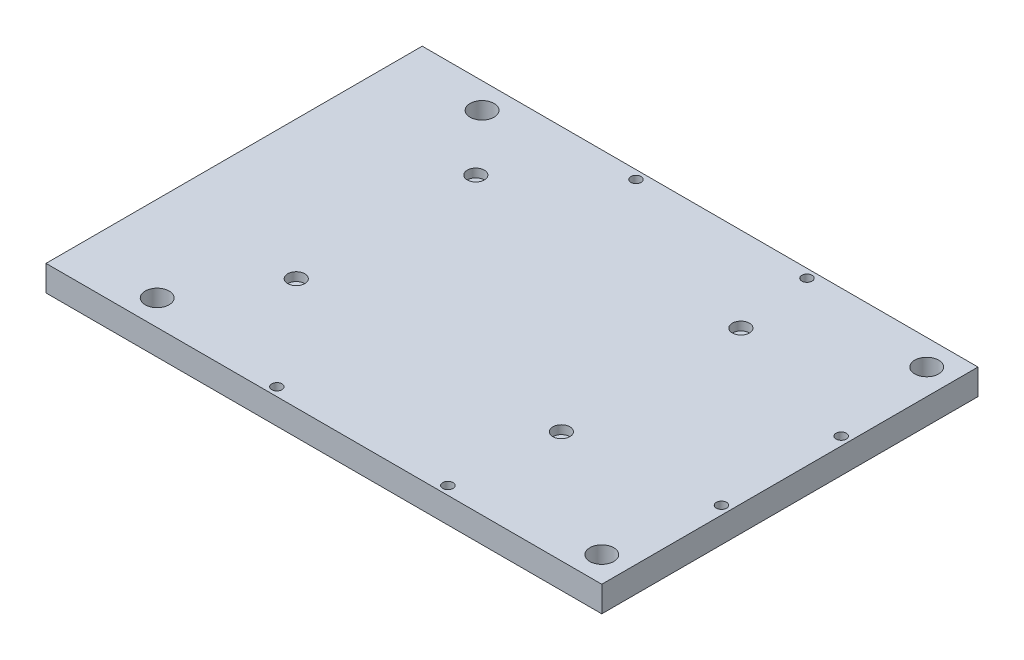
from build123d import *

# Parameters (mm, degrees)
SKETCH2_W           = 325
SKETCH2_H           = 220
SKETCH2_R           = 7
SKETCH2_R_2         = 3
BOSS_EXTRUDE3_DEPTH = 15
SKETCH11_W          = 70
SKETCH11_H          = 90
SKETCH11_W_2        = 50
SKETCH11_H_2        = 75
CUT_EXTRUDE2_DEPTH  = 8
FILLET1_R           = 3
SKETCH4_R           = 5
CUT_EXTRUDE3_DEPTH  = 5
SKETCH12_R          = 3
CUT_EXTRUDE4_DEPTH  = 5


with BuildPart() as part:
    # Sketch2 → Boss-Extrude3 (new body)
    with BuildSketch(Plane(origin=(0, 0, 0), x_dir=(1, 0, 0), z_dir=(0, 1, 0))):
        with Locations((7.596919738, 0)):
            Rectangle(SKETCH2_W, SKETCH2_H)
        with Locations(Location((155.096919738, -95, 0), (0, 0, 270))):
            Circle(SKETCH2_R, mode=Mode.SUBTRACT)
        with Locations(Location((155.096919738, 95, 0), (0, 0, 270))):
            Circle(SKETCH2_R, mode=Mode.SUBTRACT)
        with Locations(Location((-104.903080262, -95, 0), (0, 0, 270))):
            Circle(SKETCH2_R, mode=Mode.SUBTRACT)
        with Locations(Location((-104.903080262, 95, 0), (0, 0, 90))):
            Circle(SKETCH2_R, mode=Mode.SUBTRACT)
        with Locations(Location((-24.903080262, 105, 0), (0, 0, 270))):
            Circle(SKETCH2_R_2, mode=Mode.SUBTRACT)
        with Locations(Location((75.096919738, 105, 0), (0, 0, 270))):
            Circle(SKETCH2_R_2, mode=Mode.SUBTRACT)
        with Locations(Location((75.096919738, -105, 0), (0, 0, 90))):
            Circle(SKETCH2_R_2, mode=Mode.SUBTRACT)
        with Locations(Location((-24.903080262, -105, 0), (0, 0, 90))):
            Circle(SKETCH2_R_2, mode=Mode.SUBTRACT)
        with Locations(Location((165.096919738, 35, 0), (0, 0, 270))):
            Circle(SKETCH2_R_2, mode=Mode.SUBTRACT)
        with Locations(Location((165.096919738, -35, 0), (0, 0, 90))):
            Circle(SKETCH2_R_2, mode=Mode.SUBTRACT)
    extrude(amount=-BOSS_EXTRUDE3_DEPTH)

    # Sketch11 → Cut-Extrude2 (cut)
    with BuildSketch(Plane.XZ.offset(15)):
        with Locations((-39.903080262, 50)):
            Rectangle(SKETCH11_W, SKETCH11_H)
        with Locations((40.096919738, 50)):
            Rectangle(SKETCH11_W, SKETCH11_H)
        Polygon((85.096919738, 95), (135.096919738, 95), (135.096919738, 80), (155.096919738, 80), (155.096919738, 5), (85.096919738, 5), align=None)
        Polygon((85.096919738, -95), (85.096919738, -5), (155.096919738, -5), (155.096919738, -80), (135.096919738, -80), (135.096919738, -95), align=None)
        with Locations((40.096919738, -50)):
            Rectangle(SKETCH11_W, SKETCH11_H)
        with Locations((-39.903080262, -50)):
            Rectangle(SKETCH11_W, SKETCH11_H)
        with Locations((-109.903080262, -42.5)):
            Rectangle(SKETCH11_W_2, SKETCH11_H_2)
        with Locations((-109.903080262, 42.5)):
            Rectangle(SKETCH11_W_2, SKETCH11_H_2)
    extrude(amount=-CUT_EXTRUDE2_DEPTH, mode=Mode.SUBTRACT)

    # Fillet1
    fillet1_edges = [part.edges().sort_by_distance(p)[0] for p in [
        (85.096919738, -11, 95),
        (135.096919738, -11, 95),
        (135.096919738, -11, 80),
        (155.096919738, -11, 80),
        (155.096919738, -11, 5),
        (85.096919738, -11, 5),
        (75.096919738, -11, 5),
        (5.096919738, -11, 5),
        (5.096919738, -11, 95),
        (75.096919738, -11, 95),
        (-4.903080262, -11, 5),
        (-74.903080262, -11, 5),
        (-74.903080262, -11, 95),
        (-4.903080262, -11, 95),
        (-84.903080262, -11, 5),
        (-134.903080262, -11, 5),
        (-134.903080262, -11, 80),
        (-84.903080262, -11, 80),
        (-84.903080262, -11, -80),
        (-134.903080262, -11, -80),
        (-134.903080262, -11, -5),
        (-84.903080262, -11, -5),
        (-4.903080262, -11, -95),
        (-74.903080262, -11, -95),
        (-74.903080262, -11, -5),
        (75.096919738, -11, -95),
        (5.096919738, -11, -95),
        (5.096919738, -11, -5),
        (75.096919738, -11, -5),
        (85.096919738, -11, -95),
        (85.096919738, -11, -5),
        (155.096919738, -11, -5),
        (155.096919738, -11, -80),
        (135.096919738, -11, -80),
        (135.096919738, -11, -95),
    ]]
    fillet(fillet1_edges, radius=FILLET1_R)

    # Sketch4 → Cut-Extrude3 (cut)
    with BuildSketch(Plane(origin=(0, 0, 0), x_dir=(1, 0, 0), z_dir=(0, 1, 0))):
        with Locations(Location((-73.96287117, -44.592908869, 0), (0, 0, 270))):
            Circle(SKETCH4_R)
        with Locations(Location((81.03712883, -44.592908869, 0), (0, 0, 270))):
            Circle(SKETCH4_R)
        with Locations(Location((81.03712883, 60.407091131, 0), (0, 0, 270))):
            Circle(SKETCH4_R)
        with Locations(Location((-73.96287117, 60.407091131, 0), (0, 0, 270))):
            Circle(SKETCH4_R)
    extrude(amount=-CUT_EXTRUDE3_DEPTH, mode=Mode.SUBTRACT)

    # Sketch12 → Cut-Extrude4 (cut)
    with BuildSketch(Plane.ZY.offset(154.903080262)):
        with Locations((-102.5, -7.5)):
            Circle(SKETCH12_R)
        with Locations((-34.33, -7.5)):
            Circle(SKETCH12_R)
        with Locations((33.84, -7.5)):
            Circle(SKETCH12_R)
        with Locations((102.01, -7.5)):
            Circle(SKETCH12_R)
    extrude(amount=-CUT_EXTRUDE4_DEPTH, mode=Mode.SUBTRACT)


solid = part.part
